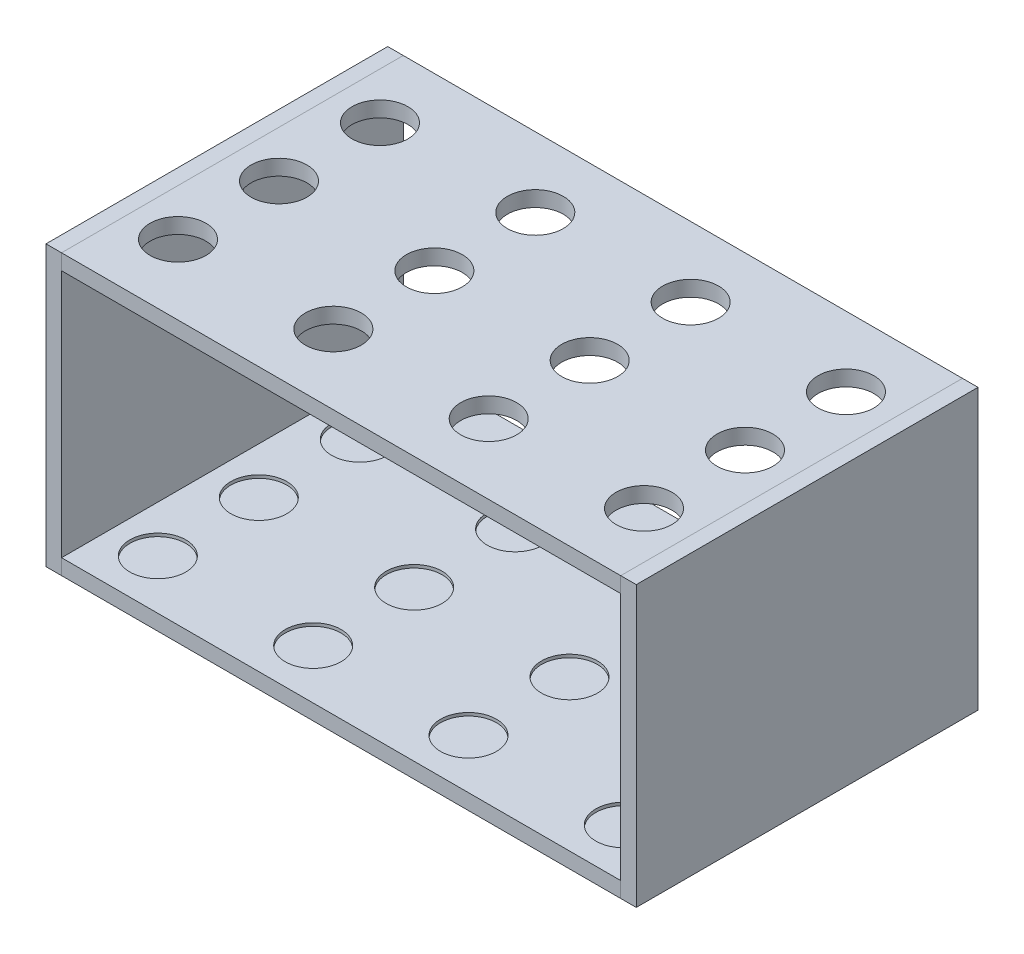
from build123d import *

# Parameters (mm, degrees)
SKETCH_1_W          = 180
SKETCH_1_H          = 110
EXTRUDE_1_DEPTH     = 5
SKETCH_2_R          = 9
CUT_EXTRUDE_4_DEPTH = 106.59356041
SKETCH_8_W          = 110
SKETCH_8_H          = 90
EXTRUDE_2_DEPTH     = 5
EXTRUDE_START       = -180
SKETCH_8_2_W        = 110
SKETCH_8_2_H        = 90
EXTRUDE_3_DEPTH     = 5
EXTRUDE_START_2     = -85
SKETCH_1_2_W        = 180
SKETCH_1_2_H        = 110
EXTRUDE_4_DEPTH     = 5
SKETCH_11_R         = 9
CUT_EXTRUDE_5_DEPTH = 1


with BuildPart() as part:
    # 草圖1 → 填料-伸長1 (new body)
    with BuildSketch(Plane(origin=(0, 0, 0), x_dir=(1, 0, 0), z_dir=(0, 1, 0))):
        Rectangle(SKETCH_1_W, SKETCH_1_H)
    extrude(amount=EXTRUDE_1_DEPTH)

    # 草圖2 → 除料-伸長4 (cut, through all)
    with BuildSketch(Plane.XZ):
        with Locations(Location((-75, 0, 0), (0, 0, 270))):
            Circle(SKETCH_2_R)
        with Locations(Location((-75, -32.5, 0), (0, 0, 270))):
            Circle(SKETCH_2_R)
        with Locations(Location((-75, 32.5, 0), (0, 0, 270))):
            Circle(SKETCH_2_R)
        with Locations(Location((-25, 32.5, 0), (0, 0, 270))):
            Circle(SKETCH_2_R)
        with Locations(Location((-25, 0, 0), (0, 0, 270))):
            Circle(SKETCH_2_R)
        with Locations(Location((-25, -32.5, 0), (0, 0, 270))):
            Circle(SKETCH_2_R)
        with Locations(Location((25, 32.5, 0), (0, 0, 270))):
            Circle(SKETCH_2_R)
        with Locations(Location((25, 0, 0), (0, 0, 270))):
            Circle(SKETCH_2_R)
        with Locations(Location((25, -32.5, 0), (0, 0, 270))):
            Circle(SKETCH_2_R)
        with Locations(Location((75, 32.5, 0), (0, 0, 270))):
            Circle(SKETCH_2_R)
        with Locations(Location((75, 0, 0), (0, 0, 270))):
            Circle(SKETCH_2_R)
        with Locations(Location((75, -32.5, 0), (0, 0, 270))):
            Circle(SKETCH_2_R)
    extrude(amount=-CUT_EXTRUDE_4_DEPTH, mode=Mode.SUBTRACT)


with BuildPart() as body_2:
    # 草圖8 → 填料-伸長2 (new body)
    with BuildSketch(Plane(origin=(90, 0, 0), x_dir=(0, 0, -1), z_dir=(1, 0, 0))):
        with Locations((0, -40)):
            Rectangle(SKETCH_8_W, SKETCH_8_H)
    extrude(amount=EXTRUDE_2_DEPTH)


with BuildPart() as body_3:
    # 草圖8<2> → 填料-伸長3 (new body)
    with BuildSketch(Plane(origin=(90, 0, 0), x_dir=(0, 0, -1), z_dir=(1, 0, 0)).offset(EXTRUDE_START)):
        with Locations((0, -40)):
            Rectangle(SKETCH_8_2_W, SKETCH_8_2_H)
    extrude(amount=-EXTRUDE_3_DEPTH)


with BuildPart() as body_4:
    # 草圖1<2> → 填料-伸長4 (new body)
    with BuildSketch(Plane(origin=(0, 0, 0), x_dir=(1, 0, 0), z_dir=(0, 1, 0)).offset(EXTRUDE_START_2)):
        Rectangle(SKETCH_1_2_W, SKETCH_1_2_H)
    extrude(amount=EXTRUDE_4_DEPTH)

    # 草圖11 → 除料-伸長5 (cut)
    with BuildSketch(Plane(origin=(0, -80, 6.5), x_dir=(1, 0, 0), z_dir=(0, -1, 0))):
        with Locations(Location((-75, 0, 0), (0, 0, 270))):
            Circle(SKETCH_11_R)
        with Locations(Location((-75, -32.5, 0), (0, 0, 270))):
            Circle(SKETCH_11_R)
        with Locations(Location((-75, 32.5, 0), (0, 0, 270))):
            Circle(SKETCH_11_R)
        with Locations(Location((-25, 32.5, 0), (0, 0, 270))):
            Circle(SKETCH_11_R)
        with Locations(Location((-25, 0, 0), (0, 0, 270))):
            Circle(SKETCH_11_R)
        with Locations(Location((-25, -32.5, 0), (0, 0, 270))):
            Circle(SKETCH_11_R)
        with Locations(Location((25, 32.5, 0), (0, 0, 270))):
            Circle(SKETCH_11_R)
        with Locations(Location((25, 0, 0), (0, 0, 270))):
            Circle(SKETCH_11_R)
        with Locations(Location((25, -32.5, 0), (0, 0, 270))):
            Circle(SKETCH_11_R)
        with Locations(Location((75, 32.5, 0), (0, 0, 270))):
            Circle(SKETCH_11_R)
        with Locations(Location((75, 0, 0), (0, 0, 270))):
            Circle(SKETCH_11_R)
        with Locations(Location((75, -32.5, 0), (0, 0, 270))):
            Circle(SKETCH_11_R)
    extrude(amount=CUT_EXTRUDE_5_DEPTH, mode=Mode.SUBTRACT)


solid = Compound([part.part, body_2.part, body_3.part, body_4.part])
